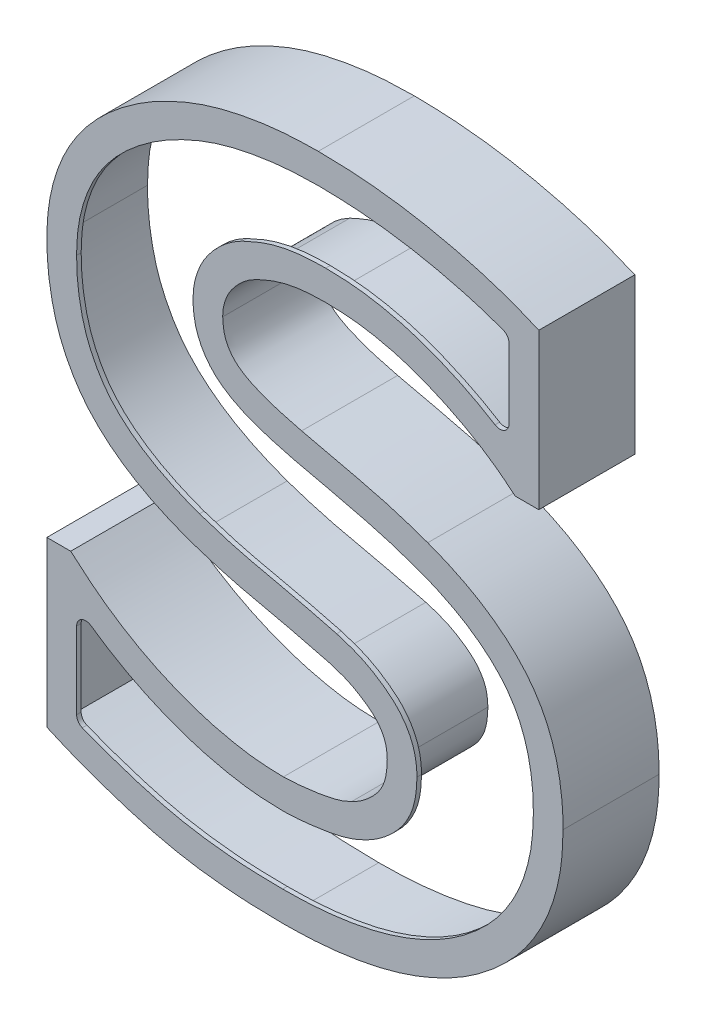
from build123d import *

# Parameters (mm, degrees)
BOSS_EXTRUDE1_DEPTH      = 1
BOSS_EXTRUDE1_DEPTH_BACK = 20
CUT_EXTRUDE3_DEPTH       = 157.135774002
CUT_EXTRUDE4_DEPTH       = 20
FILLET1_R                = 2


with BuildPart() as part:
    # Sketch1 → Boss-Extrude1 (new, two sides: drawn at the far end of the back side and taken through both)
    with BuildSketch(Plane.XY.offset(-BOSS_EXTRUDE1_DEPTH_BACK)):
        with BuildLine():
            Line((3196.172643141, -1601.823084168), (3190.957276755, -1601.823084168))
            Line((3190.957276755, -1601.823084168), (3190.957276755, -1637.755053706))
            add(Edge.make_bspline(
                [(3190.957276755, -1637.755053706), (3192.991834627, -1638.641602204), (3195.022747906, -1639.537347953), (3199.142486331, -1641.18269693), (3201.232171278, -1641.930555643), (3207.533438686, -1644.090240096), (3211.776581134, -1645.393673051), (3218.264885618, -1646.911990673), (3220.440233524, -1647.341547516), (3224.818164413, -1648.034932979), (3227.02002631, -1648.306434503), (3231.439814803, -1648.738122444), (3233.652613354, -1648.891565654), (3238.084303749, -1649.067533936), (3240.302859588, -1649.097278264), (3242.521415183, -1649.127027852)],
                knots=[0, 0, 0, 0, 0.125, 0.125, 0.25, 0.25, 0.5, 0.5, 0.625, 0.625, 0.75, 0.75, 0.875, 0.875, 1, 1, 1, 1], degree=3))
            add(Edge.make_bspline(
                [(3242.521415183, -1649.127027852), (3244.348897425, -1649.100457597), (3246.176360431, -1649.073772369), (3249.814237303, -1648.918493935), (3251.623324901, -1648.781973226), (3255.222893666, -1648.397715432), (3257.01438453, -1648.156013623), (3260.579444897, -1647.565488502), (3262.352526502, -1647.213748875), (3265.875316722, -1646.370562061), (3267.624924981, -1645.878515011), (3270.22918, -1645.019957626), (3271.093992484, -1644.714210958), (3272.817059503, -1644.063518739), (3273.675339525, -1643.718683269), (3277.905527501, -1641.911575733), (3281.129453, -1640.188050604), (3284.903710038, -1637.590332772), (3285.646163256, -1637.049290037), (3287.106656748, -1635.924871127), (3287.826595669, -1635.340031046), (3289.925389886, -1633.540674216), (3291.250659797, -1632.27857699), (3293.115611077, -1630.28143834), (3293.716097338, -1629.597825034), (3294.869196918, -1628.190108008), (3295.421572258, -1627.465803007), (3296.479765544, -1625.977815267), (3296.985622886, -1625.214165847), (3297.710315086, -1624.039855541), (3297.94615297, -1623.643575629), (3298.406036723, -1622.841042247), (3298.630526986, -1622.433918704), (3300.582420103, -1618.749699062), (3301.837034855, -1615.315859193), (3302.861228972, -1610.843510261), (3303.03920589, -1609.940151135), (3303.338794138, -1608.114779965), (3303.460005894, -1607.193392676), (3303.730457385, -1604.430092745), (3303.781118128, -1602.578913125), (3303.831038967, -1600.727682255)],
                knots=[0, 0, 0, 0, 0.0625, 0.0625, 0.125, 0.125, 0.1875, 0.1875, 0.25, 0.25, 0.3125, 0.3125, 0.34375, 0.34375, 0.375, 0.375, 0.5, 0.5, 0.53125, 0.53125, 0.5625, 0.5625, 0.625, 0.625, 0.65625, 0.65625, 0.6875, 0.6875, 0.71875, 0.71875, 0.734375, 0.734375, 0.75, 0.75, 0.875, 0.875, 0.90625, 0.90625, 0.9375, 0.9375, 1, 1, 1, 1], degree=3))
            add(Edge.make_bspline(
                [(3303.831038967, -1600.727682255), (3303.812090528, -1599.615392237), (3303.79314674, -1598.503101537), (3303.68112095, -1596.289411811), (3303.585179992, -1595.188432795), (3303.31851393, -1592.997461332), (3303.149114033, -1591.907274198), (3302.730051864, -1589.738691308), (3302.480892302, -1588.660221698), (3301.883202161, -1586.517881114), (3301.530157021, -1585.44994259), (3300.741731914, -1583.3656124), (3300.309180042, -1582.343893966), (3299.330799204, -1580.360868667), (3298.782647044, -1579.40080078), (3297.589682346, -1577.53221475), (3296.943967326, -1576.622667469), (3295.5401309, -1574.869722656), (3294.796191165, -1574.038750477), (3293.249422724, -1572.440570146), (3292.443465047, -1571.676749995), (3290.761882905, -1570.224543766), (3289.888438271, -1569.533797403), (3288.090183485, -1568.207922432), (3287.164986284, -1567.572361549), (3285.287861665, -1566.369200517), (3284.33076701, -1565.804151559), (3282.378550926, -1564.749013253), (3281.387053728, -1564.251779701), (3279.390498759, -1563.284043636), (3278.381702774, -1562.820910013), (3276.32640528, -1561.968969115), (3275.282534923, -1561.574975229), (3274.238616276, -1561.181076533)],
                knots=[0, 0, 0, 0, 0.0625, 0.0625, 0.125, 0.125, 0.1875, 0.1875, 0.25, 0.25, 0.3125, 0.3125, 0.375, 0.375, 0.4375, 0.4375, 0.5, 0.5, 0.5625, 0.5625, 0.625, 0.625, 0.6875, 0.6875, 0.75, 0.75, 0.8125, 0.8125, 0.875, 0.875, 0.9375, 0.9375, 1, 1, 1, 1], degree=3))
            add(Edge.make_bspline(
                [(3274.238616276, -1561.181076533), (3271.990075283, -1560.397861458), (3269.741514916, -1559.614704405), (3265.186697771, -1558.221179909), (3262.882847762, -1557.621661112), (3255.949587468, -1555.903960961), (3251.306032104, -1554.849865923), (3246.66282357, -1553.794472176)],
                knots=[0, 0, 0, 0, 0.25, 0.25, 0.5, 0.5, 1, 1, 1, 1], degree=3))
            add(Edge.make_bspline(
                [(3246.66282357, -1553.794472176), (3244.757153074, -1553.316482622), (3242.852533179, -1552.834706178), (3240.50761324, -1552.103246456), (3240.040275465, -1551.949531023), (3239.115007965, -1551.62087986), (3238.656591883, -1551.446562391), (3237.285486513, -1550.913795281), (3236.371544185, -1550.558314161), (3235.051333248, -1549.904975331), (3234.617476293, -1549.66837135), (3233.773906132, -1549.158483212), (3233.363555211, -1548.888482855), (3232.581517584, -1548.297569824), (3232.214337579, -1547.97072281), (3231.532670019, -1547.247644344), (3231.226074965, -1546.862910083), (3230.679299567, -1546.0529365), (3230.439314414, -1545.626819092), (3230.137177165, -1544.951052804), (3230.045903751, -1544.718370672), (3229.885407991, -1544.249467976), (3229.815830984, -1544.012785104), (3229.636785468, -1543.296528573), (3229.560363814, -1542.81004406), (3229.458098082, -1541.826498108), (3229.42963958, -1541.330748868), (3229.401645609, -1540.835919436)],
                knots=[0, 0, 0, 0, 0.25, 0.25, 0.3125, 0.3125, 0.375, 0.375, 0.5, 0.5, 0.5625, 0.5625, 0.625, 0.625, 0.6875, 0.6875, 0.75, 0.75, 0.8125, 0.8125, 0.84375, 0.84375, 0.875, 0.875, 0.9375, 0.9375, 1, 1, 1, 1], degree=3))
            add(Edge.make_bspline(
                [(3229.401645609, -1540.835919436), (3229.419611701, -1540.265675495), (3229.436656865, -1539.695255796), (3229.60800735, -1538.580612336), (3229.763258709, -1538.036569126), (3230.127291214, -1536.958698801), (3230.340079521, -1536.423700476), (3230.867217143, -1535.427585851), (3231.179381939, -1534.960212143), (3231.853541143, -1534.056927248), (3232.219030124, -1533.619569559), (3232.989846119, -1532.790206247), (3233.394215868, -1532.398493254), (3234.242073016, -1531.662451083), (3234.684923455, -1531.317350345), (3235.628751582, -1530.697559306), (3236.130858039, -1530.423851497), (3236.631290484, -1530.151038176)],
                knots=[0, 0, 0, 0, 0.125, 0.125, 0.25, 0.25, 0.375, 0.375, 0.5, 0.5, 0.625, 0.625, 0.75, 0.75, 0.875, 0.875, 1, 1, 1, 1], degree=3))
            add(Edge.make_bspline(
                [(3236.631290484, -1530.151038176), (3237.828214124, -1529.60034102), (3239.024992086, -1529.04929924), (3240.8796152, -1528.363388351), (3241.507253035, -1528.16014843), (3242.77291638, -1527.803156136), (3243.41198386, -1527.648890901), (3244.701748939, -1527.385552399), (3245.353087788, -1527.276490221), (3246.656377841, -1527.101430421), (3247.30957995, -1527.035271957), (3249.273331136, -1526.893686022), (3250.587743236, -1526.871279742), (3251.902143608, -1526.848712477)],
                knots=[0, 0, 0, 0, 0.25, 0.25, 0.375, 0.375, 0.5, 0.5, 0.625, 0.625, 0.75, 0.75, 1, 1, 1, 1], degree=3))
            add(Edge.make_bspline(
                [(3251.902143608, -1526.848712477), (3253.799536324, -1526.894677015), (3255.696963749, -1526.940301827), (3259.465744533, -1527.286766697), (3261.336862952, -1527.589906373), (3265.063795701, -1528.345983486), (3266.90456818, -1528.795535189), (3270.508191544, -1529.883731581), (3272.272742536, -1530.524111094), (3275.75509112, -1531.925680524), (3277.473812369, -1532.684483718), (3280.011354518, -1533.927442821), (3280.850280896, -1534.359646344), (3282.514901638, -1535.258244803), (3283.341760978, -1535.725254746), (3285.791753786, -1537.167028702), (3287.38887369, -1538.179808673), (3290.44827007, -1540.397520596), (3291.910857399, -1541.602009584), (3293.379571644, -1542.797767712)],
                knots=[0, 0, 0, 0, 0.125, 0.125, 0.25, 0.25, 0.375, 0.375, 0.5, 0.5, 0.625, 0.625, 0.6875, 0.6875, 0.75, 0.75, 0.875, 0.875, 1, 1, 1, 1], degree=3))
            Line((3293.379571644, -1542.797767712), (3298.51423878, -1542.797767712))
            Line((3298.51423878, -1542.797767712), (3298.51423878, -1508.81538708))
            add(Edge.make_bspline(
                [(3298.51423878, -1508.81538708), (3296.610005173, -1508.019880815), (3294.709570393, -1507.214182361), (3290.852751326, -1505.75289703), (3288.893727717, -1505.103498515), (3284.939855481, -1503.904467758), (3282.949820717, -1503.357036954), (3278.944381968, -1502.363051809), (3276.928750748, -1501.915767203), (3272.879382702, -1501.100021387), (3270.848318538, -1500.733833905), (3266.76822727, -1500.118821969), (3264.719068887, -1499.868696184), (3260.608433638, -1499.45782385), (3258.550748591, -1499.298358854), (3254.428870441, -1499.105803884), (3252.36471726, -1499.071938677), (3250.300564879, -1499.038057919)],
                knots=[0, 0, 0, 0, 0.125, 0.125, 0.25, 0.25, 0.375, 0.375, 0.5, 0.5, 0.625, 0.625, 0.75, 0.75, 0.875, 0.875, 1, 1, 1, 1], degree=3))
            add(Edge.make_bspline(
                [(3250.300564879, -1499.038057919), (3248.552853688, -1499.068743025), (3246.805166811, -1499.099559633), (3243.329802199, -1499.269408513), (3241.603348095, -1499.415058571), (3238.171337523, -1499.819379611), (3236.465245277, -1500.075152937), (3233.072711165, -1500.692974973), (3231.386047161, -1501.053822282), (3228.035842018, -1501.900572566), (3226.372867516, -1502.389540086), (3223.899613386, -1503.237688803), (3223.078653871, -1503.539109834), (3221.443917624, -1504.180798635), (3220.628122575, -1504.522209405), (3219.015890217, -1505.236154243), (3218.219236074, -1505.608605539), (3216.642748689, -1506.381025318), (3215.862658388, -1506.780573283), (3214.321941099, -1507.611509104), (3213.56135125, -1508.042957717), (3212.063148529, -1508.943442812), (3211.325826545, -1509.412955154), (3209.873256459, -1510.388090346), (3209.15795627, -1510.893627985), (3207.747657281, -1511.937914158), (3207.052369079, -1512.476189261), (3205.68442446, -1513.589762639), (3205.010587459, -1514.16642401), (3203.703436411, -1515.349610847), (3203.068715245, -1515.957360003), (3201.223019072, -1517.830706384), (3200.070245055, -1519.146174304), (3198.468482918, -1521.228540501), (3197.955835737, -1521.940891222), (3197.220845335, -1523.038534072), (3196.981522898, -1523.409277215), (3196.514717664, -1524.160908536), (3196.286956793, -1524.542339303), (3195.187965704, -1526.460183205), (3194.432732895, -1528.040352698), (3193.147267731, -1531.283994759), (3192.61452607, -1532.946538294), (3191.973808503, -1535.498996965), (3191.786323006, -1536.359474855), (3191.46889033, -1538.101733343), (3191.340467664, -1538.976439096), (3191.054316819, -1541.607340617), (3191.005000657, -1543.373125449), (3190.956929199, -1545.139014559)],
                knots=[0, 0, 0, 0, 0.0625, 0.0625, 0.125, 0.125, 0.1875, 0.1875, 0.25, 0.25, 0.3125, 0.3125, 0.34375, 0.34375, 0.375, 0.375, 0.40625, 0.40625, 0.4375, 0.4375, 0.46875, 0.46875, 0.5, 0.5, 0.53125, 0.53125, 0.5625, 0.5625, 0.59375, 0.59375, 0.625, 0.625, 0.6875, 0.6875, 0.71875, 0.71875, 0.734375, 0.734375, 0.75, 0.75, 0.8125, 0.8125, 0.875, 0.875, 0.90625, 0.90625, 0.9375, 0.9375, 1, 1, 1, 1], degree=3))
            add(Edge.make_bspline(
                [(3190.956929199, -1545.139014559), (3190.976895695, -1546.311752716), (3190.996903714, -1547.484484308), (3191.120911284, -1549.81667024), (3191.226531207, -1550.975868433), (3191.520625188, -1553.281167365), (3191.70948452, -1554.427207199), (3192.155457489, -1556.708497332), (3192.410243212, -1557.844115623), (3192.880014337, -1559.533696565), (3193.05162837, -1560.094515295), (3193.421281638, -1561.2119755), (3193.619720749, -1561.769708937), (3194.243520939, -1563.42422998), (3194.700106162, -1564.504780014), (3195.477544531, -1566.074540249), (3195.750899382, -1566.589954832), (3196.318808095, -1567.609088694), (3196.612470304, -1568.11329989), (3197.21863281, -1569.111329477), (3197.532337724, -1569.604483291), (3198.190985174, -1570.573557404), (3198.537100364, -1571.048830759), (3199.26229807, -1571.981189692), (3199.641070157, -1572.438976566), (3200.414954675, -1573.330540996), (3200.810826897, -1573.766292083), (3202.025763706, -1575.042856326), (3202.873804342, -1575.851120363), (3204.644347536, -1577.384004533), (3205.565330007, -1578.110332196), (3207.467046353, -1579.495868105), (3208.450142551, -1580.157849404), (3211.448638321, -1582.033004169), (3213.524428665, -1583.125444131), (3216.710394111, -1584.615706933), (3217.786004435, -1585.084494345), (3219.965065596, -1585.964910112), (3221.066821818, -1586.380017663), (3222.168538993, -1586.795205381)],
                knots=[0, 0, 0, 0, 0.0625, 0.0625, 0.125, 0.125, 0.1875, 0.1875, 0.25, 0.25, 0.28125, 0.28125, 0.3125, 0.3125, 0.375, 0.375, 0.40625, 0.40625, 0.4375, 0.4375, 0.46875, 0.46875, 0.5, 0.5, 0.53125, 0.53125, 0.5625, 0.5625, 0.625, 0.625, 0.6875, 0.6875, 0.75, 0.75, 0.875, 0.875, 0.9375, 0.9375, 1, 1, 1, 1], degree=3))
            add(Edge.make_bspline(
                [(3222.168538993, -1586.795205381), (3224.654424843, -1587.610275414), (3227.140303428, -1588.425368808), (3232.182289397, -1589.829755107), (3234.730739932, -1590.420367107), (3239.836589079, -1591.563994426), (3242.393864925, -1592.117592958), (3247.485276736, -1593.321770116), (3250.018330221, -1593.976899528), (3252.55131125, -1594.632332691)],
                knots=[0, 0, 0, 0, 0.25, 0.25, 0.5, 0.5, 0.75, 0.75, 1, 1, 1, 1], degree=3))
            add(Edge.make_bspline(
                [(3252.55131125, -1594.632332691), (3254.067300135, -1595.098073695), (3255.583428227, -1595.563512268), (3257.372180855, -1596.376482976), (3257.724156414, -1596.551623354), (3258.416423038, -1596.927288915), (3258.757208454, -1597.126740113), (3259.431869697, -1597.540653733), (3259.766012507, -1597.754536131), (3260.429620411, -1598.19246336), (3260.759588081, -1598.418566245), (3261.72239707, -1599.124835233), (3262.325849669, -1599.635633186), (3263.14157027, -1600.494855335), (3263.398885887, -1600.796435756), (3263.878580491, -1601.435926239), (3264.100344506, -1601.773683039), (3264.48936104, -1602.467667099), (3264.658253087, -1602.82653022), (3264.942053791, -1603.569273489), (3265.057927328, -1603.956249174), (3265.2253593, -1604.741199444), (3265.275346088, -1605.137647006), (3265.345681697, -1605.934032717), (3265.366070802, -1606.333966121), (3265.386042828, -1606.733948646)],
                knots=[0, 0, 0, 0, 0.25, 0.25, 0.3125, 0.3125, 0.375, 0.375, 0.4375, 0.4375, 0.5, 0.5, 0.625, 0.625, 0.6875, 0.6875, 0.75, 0.75, 0.8125, 0.8125, 0.875, 0.875, 0.9375, 0.9375, 1, 1, 1, 1], degree=3))
            add(Edge.make_bspline(
                [(3265.386042828, -1606.733948646), (3265.332175266, -1607.980444514), (3265.273552253, -1609.226242804), (3264.900651101, -1610.739539091), (3264.810476692, -1611.040386299), (3264.596155069, -1611.635135977), (3264.474732429, -1611.924028228), (3264.074314175, -1612.769203642), (3263.76250529, -1613.305970271), (3263.032664591, -1614.316324716), (3262.604026787, -1614.787197628), (3261.718603178, -1615.677667595), (3261.262629765, -1616.106313893), (3260.299900359, -1616.900083556), (3259.791866507, -1617.263608471), (3258.721965971, -1617.923319867), (3258.159922579, -1618.219394209), (3257.599737938, -1618.514825736)],
                knots=[0, 0, 0, 0, 0.25, 0.25, 0.3125, 0.3125, 0.375, 0.375, 0.5, 0.5, 0.625, 0.625, 0.75, 0.75, 0.875, 0.875, 1, 1, 1, 1], degree=3))
            add(Edge.make_bspline(
                [(3257.599737938, -1618.514825736), (3257.021267091, -1618.794331591), (3256.442425356, -1619.072585042), (3255.251819561, -1619.517920694), (3254.643481559, -1619.696571914), (3253.415464433, -1620.015577951), (3252.795013427, -1620.153326294), (3251.545934001, -1620.401209697), (3250.916400521, -1620.510685262), (3249.653630995, -1620.703938356), (3249.020569965, -1620.787653271), (3247.75272799, -1620.941835267), (3247.117985326, -1621.013451938), (3245.84709834, -1621.141991845), (3245.211251947, -1621.20007903), (3243.937310064, -1621.281739576), (3243.298849743, -1621.29971436), (3242.660293775, -1621.316221381)],
                knots=[0, 0, 0, 0, 0.125, 0.125, 0.25, 0.25, 0.375, 0.375, 0.5, 0.5, 0.625, 0.625, 0.75, 0.75, 0.875, 0.875, 1, 1, 1, 1], degree=3))
            add(Edge.make_bspline(
                [(3242.660293775, -1621.316221381), (3241.581443395, -1621.286504883), (3240.50261444, -1621.256612368), (3238.35071431, -1621.149521617), (3237.277805247, -1621.070991487), (3235.143018738, -1620.823295857), (3234.080536901, -1620.659096021), (3231.962396513, -1620.274636487), (3230.906574791, -1620.055717388), (3228.799790178, -1619.577959225), (3227.751520518, -1619.317248912), (3225.678619053, -1618.748077139), (3224.652720281, -1618.438495198), (3221.60692253, -1617.434186336), (3219.6167186, -1616.66911618), (3215.700443453, -1614.987054839), (3213.776709782, -1614.064526348), (3210.949357189, -1612.542752811), (3210.016283518, -1612.013281764), (3208.167686169, -1610.912766303), (3207.250526974, -1610.341109808), (3204.540901632, -1608.575566536), (3202.790497125, -1607.325353329), (3199.425599504, -1604.647348548), (3197.801552821, -1603.232039424), (3196.172643141, -1601.823084168)],
                knots=[0, 0, 0, 0, 0.0625, 0.0625, 0.125, 0.125, 0.1875, 0.1875, 0.25, 0.25, 0.3125, 0.3125, 0.375, 0.375, 0.5, 0.5, 0.625, 0.625, 0.6875, 0.6875, 0.75, 0.75, 0.875, 0.875, 1, 1, 1, 1], degree=3))
        make_face()
    extrude(amount=BOSS_EXTRUDE1_DEPTH + BOSS_EXTRUDE1_DEPTH_BACK)

    # 3DSketch3 → Cut-Extrude3 (cut, through all)
    with BuildSketch(Plane(origin=(3197.457276754, -1611.385744091, 1), x_dir=(0.6935425068211774, 0.7204157072358967, 0), z_dir=(0, 0, -1))):
        with BuildLine():
            Line((0, 0), (-15.916938943, 15.323199682))
            add(Edge.make_bspline(
                [(-15.916938943, 15.323199682), (-15.695170344, 15.900075679), (-15.47079654, 16.475928636), (-15.243091821, 17.050434333), (-14.462339414, 18.980185353), (-13.627313875, 20.88728784), (-13.018665468, 22.219024521), (-11.776205432, 24.852724022), (-10.490974451, 27.465197226), (-9.837610173, 28.756522998), (-8.506655455, 31.296386826), (-7.08854671, 33.790322845), (-6.363108611, 35.012398523), (-4.862251697, 37.427263806), (-3.256378408, 39.773096821), (-2.429703857, 40.930596252), (-0.722729146, 43.233454283), (1.055074851, 45.481614428), (1.968829061, 46.599466985), (3.530856611, 48.446808911), (5.144930156, 50.248358996), (5.802332326, 50.969096807), (6.785486568, 52.033512008), (7.7742257, 53.092516417), (8.09769841, 53.438151029), (8.421384567, 53.783578848), (8.74509276, 54.128985316)],
                knots=[0, 0, 0, 0, 0, 0, 0.066712718, 0.066712718, 0.066712718, 0.224740304, 0.224740304, 0.224740304, 0.380960058, 0.380960058, 0.380960058, 0.534292009, 0.534292009, 0.534292009, 0.687778208, 0.687778208, 0.687778208, 0.843592738, 0.843592738, 0.843592738, 0.948894347, 0.948894347, 0.948894347, 1, 1, 1, 1, 1, 1], degree=5))
            add(Edge.make_bspline(
                [(8.74509276, 54.128985316), (8.980690815, 54.366693505), (9.216304213, 54.604387105), (9.452026758, 54.841976094), (10.173025629, 55.567463881), (10.896797085, 56.290294289), (11.386247706, 56.774058617), (12.613871692, 57.968492108), (13.872632172, 59.130599402), (14.63641705, 59.814121397), (16.168125299, 61.143156018), (17.738881049, 62.425500787), (18.525134686, 63.048107671), (20.197175636, 64.33195702), (21.909170574, 65.562693153), (22.818609288, 66.19099884), (24.753306769, 67.468661864), (26.748691186, 68.651524045), (27.808550914, 69.243800536), (30.038138263, 70.415677763), (32.327388467, 71.466232757), (33.528613612, 71.975885238), (35.853146158, 72.880337184), (38.229188277, 73.643994241), (39.37297023, 73.973479134), (41.556880291, 74.526574806), (43.771256844, 74.935998108), (44.821689588, 75.098081651), (46.816580485, 75.347461543), (48.821936192, 75.491763979), (49.768594271, 75.534289245), (51.651968623, 75.563895675), (53.53450151, 75.475789348), (54.468450629, 75.401937065), (56.318883893, 75.193387012), (58.1506124, 74.858245378), (59.055180973, 74.661229924), (60.85618732, 74.206459241), (62.623822834, 73.635787325), (63.500755969, 73.320399575), (65.138506026, 72.668795634), (66.730838588, 71.913514272), (67.471001603, 71.53568934), (68.840873449, 70.787467412), (70.170806462, 69.97143609), (70.783151432, 69.574722949), (71.924655821, 68.793198968), (73.025438326, 67.955449538), (73.537306316, 67.54828882), (74.382885604, 66.84885245), (75.207912748, 66.126118872), (75.538704261, 65.831298483), (76.02268576, 65.394989257), (76.504844884, 64.956713701), (76.658999744, 64.816326976), (76.813077396, 64.675856944), (76.967132537, 64.535362622)],
                knots=[0, 0, 0, 0, 0, 0, 0.021560593, 0.021560593, 0.021560593, 0.065890122, 0.065890122, 0.065890122, 0.131896829, 0.131896829, 0.131896829, 0.196489047, 0.196489047, 0.196489047, 0.26766733, 0.26766733, 0.26766733, 0.345799948, 0.345799948, 0.345799948, 0.42977147, 0.42977147, 0.42977147, 0.506327302, 0.506327302, 0.506327302, 0.574732488, 0.574732488, 0.574732488, 0.635717767, 0.635717767, 0.635717767, 0.695981503, 0.695981503, 0.695981503, 0.755531895, 0.755531895, 0.755531895, 0.815480347, 0.815480347, 0.815480347, 0.868947063, 0.868947063, 0.868947063, 0.915915415, 0.915915415, 0.915915415, 0.958024713, 0.958024713, 0.958024713, 0.98656827, 0.98656827, 0.98656827, 1, 1, 1, 1, 1, 1], degree=5))
            add(Edge.make_bspline(
                [(76.967132537, 64.535362622), (77.093990655, 64.40898879), (77.220826643, 64.28259184), (77.347594249, 64.156123583), (77.755852308, 63.74807576), (78.162439108, 63.338285188), (78.441209432, 63.053972912), (79.125719939, 62.343237569), (79.789006595, 61.612282656), (80.176927182, 61.169292299), (80.923143306, 60.286140435), (81.638196718, 59.377756666), (81.981374625, 58.925961394), (82.64826737, 58.01532854), (83.282787241, 57.08141372), (83.589154349, 56.610841601), (84.175538376, 55.665756709), (84.716418633, 54.694013564), (84.973620081, 54.206810058), (85.461913775, 53.233157853), (85.912275049, 52.241031827), (86.123517442, 51.745899259), (86.516420275, 50.752480154), (86.84874865, 49.736840175), (86.999292568, 49.228112207), (87.320556569, 48.023317388), (87.568224271, 46.801504136), (87.686261411, 46.094932304), (87.901540371, 44.46539141), (87.989512556, 42.822256335), (88.001920259, 41.893135637), (87.958567283, 40.02173317), (87.790906519, 38.160182117), (87.677084406, 37.225916086), (87.419392444, 35.526504893), (87.077928384, 33.842756948), (86.90624657, 33.084477957), (86.574193962, 31.758450655), (86.189202869, 30.447275742), (86.015125724, 29.883972709), (85.648876458, 28.743020665), (85.264874294, 27.60784941), (85.063164367, 27.033674011), (84.712338839, 26.08209366), (84.331361993, 25.142164081), (84.175415042, 24.767519571), (83.942258289, 24.216653584), (83.707063002, 23.666757449), (83.631285683, 23.489998186), (83.555426896, 23.313277682), (83.479551306, 23.136565172)],
                knots=[0, 0, 0, 0, 0, 0, 0.019748125, 0.019748125, 0.019748125, 0.063656856, 0.063656856, 0.063656856, 0.128567156, 0.128567156, 0.128567156, 0.191117743, 0.191117743, 0.191117743, 0.253005259, 0.253005259, 0.253005259, 0.313731143, 0.313731143, 0.313731143, 0.373049362, 0.373049362, 0.373049362, 0.431493862, 0.431493862, 0.431493862, 0.510413352, 0.510413352, 0.510413352, 0.612581956, 0.612581956, 0.612581956, 0.716236747, 0.716236747, 0.716236747, 0.801930952, 0.801930952, 0.801930952, 0.866941832, 0.866941832, 0.866941832, 0.93404332, 0.93404332, 0.93404332, 0.978790468, 0.978790468, 0.978790468, 1, 1, 1, 1, 1, 1], degree=5))
            add(Edge.make_bspline(
                [(83.479551306, 23.136565172), (83.329218198, 22.809824369), (83.178869806, 22.483090323), (83.028395777, 22.156410797), (82.574674019, 21.173229969), (82.117814056, 20.191410973), (81.809641008, 19.537165489), (81.026431467, 17.90530007), (80.203143326, 16.29305344), (79.695928256, 15.331469572), (78.665481756, 13.432229322), (77.597006983, 11.554667503), (77.059247654, 10.625698899), (75.944872923, 8.721243345), (74.822780203, 6.821415064), (74.244569171, 5.846974601), (73.270544003, 4.212850794), (72.291255537, 2.581862025), (71.894600884, 1.922677678), (71.287721512, 0.915546421), (70.672940163, -0.103708161), (70.455467645, -0.464174017), (70.237978622, -0.824629775), (70.020490188, -1.185085893), (70.013017022, -1.197471602)],
                knots=[0, 0, 0, 0, 0, 0, 0.064613352, 0.064613352, 0.064613352, 0.194522523, 0.194522523, 0.194522523, 0.389780192, 0.389780192, 0.389780192, 0.582607391, 0.582607391, 0.582607391, 0.786163168, 0.786163168, 0.786163168, 0.924370446, 0.924370446, 0.924370446, 0.997401277, 1, 1, 1, 1, 1, 1], degree=5))
            add(Edge.make_bspline(
                [(70.013017022, -1.197471602), (70.005821314, -1.210020538), (69.998625605, -1.222569473), (69.853017963, -1.476501507), (69.707403906, -1.730429692), (69.561926091, -1.984439599), (69.142729936, -2.718130638), (68.726947973, -3.453869587), (68.450839786, -3.948861064), (67.75721105, -5.21599477), (67.097348951, -6.501019153), (66.709153133, -7.288481721), (66.020200473, -8.746910671), (65.37648859, -10.227477444), (65.096640449, -10.907506592), (64.623743239, -12.144583245), (64.220359762, -13.405932604), (64.055881721, -13.971875314), (63.7950681, -14.97583937), (63.5887288, -15.992851782), (63.511474412, -16.434347875), (63.379169842, -17.355779128), (63.312749913, -18.285319406), (63.296596969, -18.768550077), (63.301867633, -19.707351905), (63.380471087, -20.64275924), (63.435457273, -21.0949374), (63.569923099, -21.941527311), (63.761228282, -22.776567492), (63.863580433, -23.164865232), (64.078726986, -23.882983009), (64.33936554, -24.585960659), (64.470057467, -24.908835912), (64.768259382, -25.587325238), (65.108356472, -26.245775277), (65.300054052, -26.588754275), (65.707181809, -27.264421709), (66.157503799, -27.912297277), (66.393315072, -28.230662756), (66.810306362, -28.762314537), (67.249206943, -29.27496733), (67.433829924, -29.484420609), (67.700775207, -29.78058967), (67.970933652, -30.073754146), (68.052111081, -30.161455565), (68.172314843, -30.291032852), (68.292518605, -30.42061014), (68.331448692, -30.462576006), (68.370378778, -30.504541872), (68.409308864, -30.546507738)],
                knots=[0, 0, 0, 0, 0, 0, 0.002246861, 0.002246861, 0.045466016, 0.045466016, 0.045466016, 0.133492009, 0.133492009, 0.133492009, 0.269833312, 0.269833312, 0.269833312, 0.383912937, 0.383912937, 0.383912937, 0.475392088, 0.475392088, 0.475392088, 0.544939264, 0.544939264, 0.544939264, 0.619866159, 0.619866159, 0.619866159, 0.69046605, 0.69046605, 0.69046605, 0.752763621, 0.752763621, 0.752763621, 0.806799803, 0.806799803, 0.806799803, 0.867753586, 0.867753586, 0.867753586, 0.929188207, 0.929188207, 0.929188207, 0.972547021, 0.972547021, 0.972547021, 0.991108873, 0.991108873, 0.991108873, 1, 1, 1, 1, 1, 1], degree=5))
            add(Edge.make_bspline(
                [(68.409308864, -30.546507738), (68.45177686, -30.584889437), (68.494244857, -30.623271137), (68.536712853, -30.661652836), (68.654249877, -30.767880376), (68.771786902, -30.874107915), (68.846945747, -30.941855882), (69.096963259, -31.166033986), (69.349948243, -31.386978419), (69.528654722, -31.539090701), (69.98313057, -31.913330558), (70.456268396, -32.264876831), (70.747179947, -32.467606979), (71.358034244, -32.865851559), (71.992756906, -33.223351236), (72.324224375, -33.397634365), (72.98568095, -33.725023863), (73.659538413, -34.025966252), (73.994661336, -34.166484322), (74.671564518, -34.429443308), (75.363477649, -34.651458445), (75.712481521, -34.752188805), (76.453114819, -34.942799968), (77.203465129, -35.088154935), (77.599605878, -35.15321045), (78.431309438, -35.268208477), (79.26738019, -35.344457925), (79.704512666, -35.373653267), (80.631124947, -35.412949046), (81.55850131, -35.404376437), (82.047661938, -35.386460977), (83.014076067, -35.324405042), (83.9763318, -35.209455329), (84.450227523, -35.138363573), (85.235795934, -34.993842799), (86.010842071, -34.802373559), (86.319591214, -34.719349193), (86.770388633, -34.58992793), (87.218300236, -34.451826916), (87.360691142, -34.407278165), (87.54509486, -34.349165703), (87.729498579, -34.291053242), (87.771608871, -34.277782725), (87.813719162, -34.264512207), (87.855829454, -34.25124169)],
                knots=[0, 0, 0, 0, 0, 0, 0.013739626, 0.013739626, 0.013739626, 0.038026629, 0.038026629, 0.038026629, 0.094338228, 0.094338228, 0.094338228, 0.179290557, 0.179290557, 0.179290557, 0.269110399, 0.269110399, 0.269110399, 0.356270713, 0.356270713, 0.356270713, 0.443339288, 0.443339288, 0.443339288, 0.539618085, 0.539618085, 0.539618085, 0.644685774, 0.644685774, 0.644685774, 0.762075937, 0.762075937, 0.762075937, 0.87691123, 0.87691123, 0.87691123, 0.953592565, 0.953592565, 0.953592565, 0.989402434, 0.989402434, 0.989402434, 1, 1, 1, 1, 1, 1], degree=5))
            add(Edge.make_bspline(
                [(87.855829454, -34.25124169), (87.896942338, -34.235144669), (87.938055222, -34.219047648), (87.979168106, -34.202950627), (88.201217922, -34.116010958), (88.423267739, -34.029071289), (88.604155764, -33.958101396), (89.162538933, -33.738119927), (89.719522491, -33.514496997), (90.095079235, -33.360582609), (91.046093032, -32.959754056), (91.984245655, -32.528187962), (92.547669251, -32.254043302), (93.676252421, -31.671233949), (94.772600653, -31.029682902), (95.319905935, -30.690446964), (96.391870324, -29.989622066), (97.430560617, -29.240847179), (97.938586792, -28.857057169), (98.913122837, -28.086417426), (99.853724223, -27.275055716), (100.305041432, -26.870978687), (101.039105958, -26.192100428), (101.757241899, -25.49691133), (102.038362399, -25.220927031), (102.452624655, -24.810112555), (102.865005586, -24.397433521), (102.998800788, -24.263278111), (103.151520299, -24.109996841), (103.30423981, -23.956715572), (103.323230262, -23.937655266), (103.342220713, -23.918594961), (103.361211165, -23.899534655)],
                knots=[0, 0, 0, 0, 0, 0, 0.011724386, 0.011724386, 0.011724386, 0.063323162, 0.063323162, 0.063323162, 0.171090803, 0.171090803, 0.171090803, 0.33734399, 0.33734399, 0.33734399, 0.508181057, 0.508181057, 0.508181057, 0.677143924, 0.677143924, 0.677143924, 0.837934339, 0.837934339, 0.837934339, 0.942542098, 0.942542098, 0.942542098, 0.992855192, 0.992855192, 0.992855192, 1, 1, 1, 1, 1, 1], degree=5))
            add(Edge.make_bspline(
                [(103.361211165, -23.899534655), (103.379396713, -23.87970492), (103.397582261, -23.859875186), (103.415767809, -23.840045452), (103.655399296, -23.578748472), (103.895030783, -23.317451492), (104.116283818, -23.075799397), (104.780366176, -22.348111522), (105.439216815, -21.615410393), (105.874692242, -21.12263746), (106.960658071, -19.862759331), (107.994901944, -18.559263323), (108.602070445, -17.756636516), (109.780767857, -16.126381869), (110.892273759, -14.4505294), (111.431587299, -13.602504331), (112.481833903, -11.882734686), (113.472209031, -10.127481973), (113.952214048, -9.238576969), (114.965604614, -7.269351938), (115.886560189, -5.255272916), (116.362946539, -4.148506172), (117.358334312, -1.70512947), (118.262825563, 0.772669097), (118.7268103, 2.128524149), (119.662367907, 5.057779354), (120.466599677, 8.028231814), (120.852285856, 9.625410545), (121.240517015, 11.484829126), (121.553441922, 13.357505443), (121.594464442, 13.611246041), (121.634188133, 13.865200591), (121.67265362, 14.11935459)],
                knots=[0, 0, 0, 0, 0, 0, 0.003140848, 0.003140848, 0.003140848, 0.041387049, 0.041387049, 0.041387049, 0.11813585, 0.11813585, 0.11813585, 0.235527906, 0.235527906, 0.235527906, 0.352798176, 0.352798176, 0.352798176, 0.470664566, 0.470664566, 0.470664566, 0.611239697, 0.611239697, 0.611239697, 0.77844678, 0.77844678, 0.77844678, 0.9700074, 0.9700074, 0.9700074, 1, 1, 1, 1, 1, 1], degree=5))
            Line((121.67265362, 14.11935459), (136.339101202, 0))
            add(Edge.make_bspline(
                [(136.339101202, 0), (136.159987849, -0.441557905), (135.97871238, -0.882211214), (135.794738856, -1.321713751), (135.082512294, -2.98847606), (134.315719557, -4.63145566), (133.72527233, -5.83095554), (132.497712298, -8.219318012), (131.204352737, -10.571257851), (130.539099582, -11.743190012), (129.182164083, -14.062975999), (127.767926532, -16.348770536), (127.047906413, -17.479123973), (125.571735286, -19.727122157), (124.030258341, -21.930688093), (123.241129914, -23.025113879), (121.636833145, -25.186312889), (119.975068545, -27.304017727), (119.131010192, -28.347863677), (117.690194578, -30.072873501), (116.200508065, -31.755486443), (115.594163869, -32.427717223), (114.692749, -33.413290944), (113.78481423, -34.392628304), (113.491820759, -34.707722912), (113.198579652, -35.022580655), (112.905305505, -35.337406794)],
                knots=[0, 0, 0, 0, 0, 0, 0.05587978, 0.05587978, 0.05587978, 0.212593297, 0.212593297, 0.212593297, 0.37062696, 0.37062696, 0.37062696, 0.527769057, 0.527769057, 0.527769057, 0.685982192, 0.685982192, 0.685982192, 0.843374159, 0.843374159, 0.843374159, 0.949536075, 0.949536075, 0.949536075, 1, 1, 1, 1, 1, 1], degree=5))
            add(Edge.make_bspline(
                [(112.905305505, -35.337406794), (112.684032406, -35.559315914), (112.462738837, -35.781205438), (112.241328391, -36.002982231), (111.558352501, -36.685795407), (110.872434092, -37.365770487), (110.406492299, -37.82244337), (109.238022229, -38.948284842), (108.037875834, -40.040930434), (107.30925838, -40.682107655), (105.845631355, -41.926836344), (104.34132, -43.121717895), (103.587439483, -43.701037322), (101.983653763, -44.8942943), (100.342864071, -46.036352449), (99.471611467, -46.619371791), (97.617270553, -47.807003743), (95.709171128, -48.908926088), (94.69510305, -49.461055751), (92.553612055, -50.555217134), (90.353681113, -51.525274166), (89.195702533, -51.997365904), (86.950980095, -52.843260363), (84.667287982, -53.579383415), (83.565620494, -53.903421159), (81.459865589, -54.458507279), (79.325518809, -54.889038866), (78.31081958, -55.065252557), (76.387491376, -55.347038316), (74.452411297, -55.534612072), (73.540678728, -55.599664805), (71.733651656, -55.678047019), (69.924545224, -55.647654219), (69.030102064, -55.605385803), (67.26170946, -55.466505054), (65.505088204, -55.216018398), (64.63964621, -55.063281105), (62.924598494, -54.698568565), (61.240415756, -54.209124995), (60.409149655, -53.93476647), (58.856508865, -53.360479808), (57.346211098, -52.684799399), (56.644016866, -52.345189729), (55.34754699, -51.672192665), (54.086870916, -50.934845593), (53.508328982, -50.57643854), (52.429315509, -49.866437655), (51.391483174, -49.097486734), (50.909077822, -48.72174185), (50.114872621, -48.074790671), (49.342847758, -47.40249699), (49.034336376, -47.128442308), (48.583000613, -46.722263108), (48.13353654, -46.314078783), (47.989670482, -46.183155829), (47.845884964, -46.052146594), (47.702124194, -45.921110846)],
                knots=[0, 0, 0, 0, 0, 0, 0.021247441, 0.021247441, 0.021247441, 0.06547803, 0.06547803, 0.06547803, 0.131255466, 0.131255466, 0.131255466, 0.195698449, 0.195698449, 0.195698449, 0.266749901, 0.266749901, 0.266749901, 0.344949258, 0.344949258, 0.344949258, 0.42965748, 0.42965748, 0.42965748, 0.507424926, 0.507424926, 0.507424926, 0.577196347, 0.577196347, 0.577196347, 0.639112268, 0.639112268, 0.639112268, 0.699747916, 0.699747916, 0.699747916, 0.759240007, 0.759240007, 0.759240007, 0.818484231, 0.818484231, 0.818484231, 0.871305394, 0.871305394, 0.871305394, 0.917408804, 0.917408804, 0.917408804, 0.95883528, 0.95883528, 0.95883528, 0.986811364, 0.986811364, 0.986811364, 1, 1, 1, 1, 1, 1], degree=5))
            add(Edge.make_bspline(
                [(47.702124194, -45.921110846), (47.567652971, -45.787155399), (47.433206856, -45.653173688), (47.298841355, -45.519108203), (46.868003176, -45.08834261), (46.439137409, -44.655527246), (46.145780894, -44.355700142), (45.423736204, -43.603662291), (44.725248435, -42.829207899), (44.316481005, -42.358553301), (43.529424261, -41.417085768), (42.778243043, -40.447121207), (42.416786265, -39.963580316), (41.671275502, -38.932856813), (40.957272336, -37.879790063), (40.593162073, -37.319276996), (39.868502828, -36.144118517), (39.210664002, -34.928818846), (38.889530223, -34.291972387), (38.26094544, -32.949454757), (37.715565886, -31.572027124), (37.454497266, -30.848725592), (36.97809983, -29.395306536), (36.585073294, -27.915876788), (36.413631267, -27.174497713), (36.123347279, -25.670722449), (35.957447372, -24.147939981), (35.902746279, -23.378106423), (35.844911548, -21.817215938), (35.88299216, -20.257280309), (35.925709184, -19.469104899), (36.051003589, -17.95482223), (36.255138095, -16.449267966), (36.370313736, -15.728106475), (36.625474576, -14.329979519), (36.936651217, -12.943877457), (37.100473183, -12.272911439), (37.435979061, -10.997072674), (37.812028949, -9.732689143), (37.999841799, -9.132825939), (38.400074243, -7.91238267), (38.831564867, -6.702686845), (39.059995567, -6.087966958), (39.453969119, -5.06911916), (39.870228202, -4.059324493), (40.039253532, -3.656792294), (40.286973751, -3.073878865), (40.536408837, -2.491734615), (40.614023817, -2.310919211), (40.691707859, -2.130134784), (40.769412726, -1.949359697)],
                knots=[0, 0, 0, 0, 0, 0, 0.019689006, 0.019689006, 0.019689006, 0.063196076, 0.063196076, 0.063196076, 0.12782584, 0.12782584, 0.12782584, 0.19043064, 0.19043064, 0.19043064, 0.259732559, 0.259732559, 0.259732559, 0.333600712, 0.333600712, 0.333600712, 0.413294469, 0.413294469, 0.413294469, 0.492091777, 0.492091777, 0.492091777, 0.571995429, 0.571995429, 0.571995429, 0.653797211, 0.653797211, 0.653797211, 0.729487127, 0.729487127, 0.729487127, 0.801108009, 0.801108009, 0.801108009, 0.866293847, 0.866293847, 0.866293847, 0.934304479, 0.934304479, 0.934304479, 0.979588876, 0.979588876, 0.979588876, 1, 1, 1, 1, 1, 1], degree=5))
            add(Edge.make_bspline(
                [(40.769412726, -1.949359697), (40.88569392, -1.708377664), (41.001990669, -1.467402905), (41.118351564, -1.226459132), (41.48242938, -0.473478676), (41.848085354, 0.278739475), (42.098150269, 0.789637476), (42.725526435, 2.058526793), (43.369639945, 3.319247425), (43.761957572, 4.069708002), (44.570924191, 5.577090461), (45.417212622, 7.063739858), (45.852054289, 7.810349624), (46.749172143, 9.325597813), (47.65986367, 10.832420593), (48.126040493, 11.598437697), (49.069149997, 13.142887559), (50.012156657, 14.687483661), (50.486556525, 15.467501984), (51.426246499, 17.024288206), (52.350385574, 18.590386068), (52.806976166, 19.37232564), (53.560491666, 20.675346538), (54.305655615, 21.983117195), (54.601543232, 22.50474894), (55.047183403, 23.29282541), (55.50628982, 24.106788203), (55.670691981, 24.398451462), (55.835065127, 24.690131018), (55.999441099, 24.981808987), (56.013759629, 25.007216591)],
                knots=[0, 0, 0, 0, 0, 0, 0.043180121, 0.043180121, 0.043180121, 0.134973993, 0.134973993, 0.134973993, 0.27160926, 0.27160926, 0.27160926, 0.411024889, 0.411024889, 0.411024889, 0.555739442, 0.555739442, 0.555739442, 0.70306817, 0.70306817, 0.70306817, 0.849189626, 0.849189626, 0.849189626, 0.945969335, 0.945969335, 0.945969335, 0.995293475, 1, 1, 1, 1, 1, 1], degree=5))
            add(Edge.make_bspline(
                [(56.013759629, 25.007216591), (56.026924327, 25.033240761), (56.040089026, 25.05926493), (56.053253724, 25.085289099), (56.174991949, 25.325943009), (56.296730174, 25.566596919), (56.405056481, 25.781357497), (56.743290134, 26.455812664), (57.074226833, 27.134129664), (57.293841768, 27.598975354), (57.824825345, 28.776201557), (58.288430211, 29.983482432), (58.54221298, 30.719734494), (58.961556111, 32.091113027), (59.289280486, 33.485838191), (59.421234831, 34.127476237), (59.624531571, 35.263738706), (59.780354996, 36.407479974), (59.836389745, 36.903377482), (59.909773815, 37.767567585), (59.93387653, 38.634827731), (59.934942269, 39.003499589), (59.917797448, 39.756841956), (59.859988574, 40.508289496), (59.819586174, 40.891168781), (59.719382403, 41.632809016), (59.576065592, 42.367516464), (59.496202859, 42.722188845), (59.324743874, 43.391249754), (59.115492497, 44.049264003), (59.007856588, 44.35818307), (58.788741849, 44.934957424), (58.539240092, 45.499268495), (58.415375036, 45.761440594), (58.138040296, 46.312116716), (57.831460985, 46.847138606), (57.66093099, 47.125813534), (57.303866064, 47.672845002), (56.9150883, 48.19789711), (56.713795652, 48.455256022), (56.36089485, 48.885406625), (55.993713035, 49.302720632), (55.840145681, 49.473192429), (55.619723081, 49.71343013), (55.397083248, 49.951583104), (55.330984464, 50.022026692), (55.223351462, 50.13652288), (55.11571846, 50.251019067), (55.074249131, 50.295132676), (55.032779801, 50.339246285), (54.991310471, 50.383359894)],
                knots=[0, 0, 0, 0, 0, 0, 0.005316523, 0.005316523, 0.005316523, 0.04916361, 0.04916361, 0.04916361, 0.142850633, 0.142850633, 0.142850633, 0.284516976, 0.284516976, 0.284516976, 0.403812829, 0.403812829, 0.403812829, 0.494716462, 0.494716462, 0.494716462, 0.561864282, 0.561864282, 0.561864282, 0.6319698, 0.6319698, 0.6319698, 0.698153195, 0.698153195, 0.698153195, 0.757735872, 0.757735872, 0.757735872, 0.810548627, 0.810548627, 0.810548627, 0.870047279, 0.870047279, 0.870047279, 0.929532582, 0.929532582, 0.929532582, 0.971353513, 0.971353513, 0.971353513, 0.988962952, 0.988962952, 0.988962952, 1, 1, 1, 1, 1, 1], degree=5))
            add(Edge.make_bspline(
                [(54.991310471, 50.383359894), (54.945920521, 50.423428189), (54.900530571, 50.463496483), (54.855140621, 50.503564778), (54.699688037, 50.64079163), (54.544235453, 50.778018482), (54.434051349, 50.875039537), (54.071965433, 51.192266016), (53.705961533, 51.505057398), (53.449063976, 51.719516162), (52.818780315, 52.230272833), (52.166397897, 52.714400423), (51.774998641, 52.987518539), (50.98200556, 53.502343847), (50.152642055, 53.956517325), (49.73362991, 54.166281475), (48.928270635, 54.533056451), (48.099762497, 54.842811966), (47.705301777, 54.976204976), (46.859000949, 55.233754205), (45.997807225, 55.437488504), (45.538480586, 55.529133152), (44.584832041, 55.682532459), (43.621835908, 55.757539499), (43.124026001, 55.778721515), (42.078826298, 55.793518987), (41.03534207, 55.760906701), (40.490318004, 55.729308822), (39.440797327, 55.637243942), (38.397846293, 55.479393001), (37.897614972, 55.387797247), (37.068107563, 55.208589536), (36.250417709, 54.984818806), (35.924192289, 54.889206535), (35.450662742, 54.743109606), (34.979562936, 54.58994114), (34.831785963, 54.541377657), (34.662354713, 54.48540124), (34.492923464, 54.429424824), (34.471189321, 54.422244333), (34.449455179, 54.415063843), (34.427721036, 54.407883353)],
                knots=[0, 0, 0, 0, 0, 0, 0.013641237, 0.013641237, 0.013641237, 0.046718835, 0.046718835, 0.046718835, 0.122101373, 0.122101373, 0.122101373, 0.229433391, 0.229433391, 0.229433391, 0.334824611, 0.334824611, 0.334824611, 0.428531109, 0.428531109, 0.428531109, 0.533895567, 0.533895567, 0.533895567, 0.645936526, 0.645936526, 0.645936526, 0.768868441, 0.768868441, 0.768868441, 0.883239161, 0.883239161, 0.883239161, 0.959796581, 0.959796581, 0.959796581, 0.994842824, 0.994842824, 0.994842824, 1, 1, 1, 1, 1, 1], degree=5))
            add(Edge.make_bspline(
                [(34.427721036, 54.407883353), (34.406253146, 54.399942189), (34.384785256, 54.392001025), (34.363317366, 54.384059861), (34.13176468, 54.298406458), (33.900211994, 54.212753055), (33.690454683, 54.134135358), (33.070936342, 53.895845342), (32.460041915, 53.633711292), (32.059678724, 53.449806932), (31.089932571, 52.97425395), (30.152953698, 52.439704352), (29.607845725, 52.106326117), (28.564214692, 51.433336594), (27.544419041, 50.726043288), (27.054934931, 50.37505024), (26.108301001, 49.674427334), (25.181910492, 48.947460356), (24.733090753, 48.58731005), (23.848871996, 47.866153881), (22.971934509, 47.136253571), (22.540275535, 46.771004009), (21.827227306, 46.153719106), (21.129075303, 45.519262256), (20.852002723, 45.262412203), (20.440380859, 44.872980988), (20.03499673, 44.47725493), (19.900343723, 44.344892809), (19.741212949, 44.187924637), (19.582082176, 44.030956464), (19.557373428, 44.00658351), (19.532664679, 43.982210555), (19.507955931, 43.957837601)],
                knots=[0, 0, 0, 0, 0, 0, 0.006238383, 0.006238383, 0.006238383, 0.067287202, 0.067287202, 0.067287202, 0.187110886, 0.187110886, 0.187110886, 0.361112148, 0.361112148, 0.361112148, 0.525229456, 0.525229456, 0.525229456, 0.682046725, 0.682046725, 0.682046725, 0.836146307, 0.836146307, 0.836146307, 0.939081023, 0.939081023, 0.939081023, 0.990540914, 0.990540914, 0.990540914, 1, 1, 1, 1, 1, 1], degree=5))
            add(Edge.make_bspline(
                [(19.507955931, 43.957837601), (19.484582849, 43.932180979), (19.461209768, 43.906524357), (19.437836687, 43.880867736), (19.16184525, 43.57791205), (18.885853812, 43.274956364), (18.633542448, 42.997360583), (17.882039759, 42.166760203), (17.138747207, 41.328224466), (16.650669411, 40.765095362), (15.441497843, 39.32547087), (14.305800086, 37.826619731), (13.64395833, 36.903575126), (12.362949971, 35.02953087), (11.153160978, 33.110287037), (10.566714966, 32.140494776), (9.428234949, 30.176457601), (8.363255063, 28.171110028), (7.848884136, 27.156841758), (6.802586144, 24.992008585), (5.846131446, 22.786266622), (5.366006798, 21.613409557), (4.396552324, 19.106408863), (3.526304094, 16.562866398), (3.095321242, 15.20896021), (2.352106955, 12.68157461), (1.716859742, 10.124789987), (1.446483441, 8.941443604), (1.022096323, 6.91447319), (0.65891293, 4.876452455), (0.51971732, 4.031026357), (0.322363954, 2.718748032), (0.154839255, 1.402322159), (0.099294617, 0.935304595), (0.047655084, 0.467849909), (0, 0)],
                knots=[0, 0, 0, 0, 0, 0, 0.003546756, 0.003546756, 0.003546756, 0.041880415, 0.041880415, 0.041880415, 0.118001055, 0.118001055, 0.118001055, 0.233966623, 0.233966623, 0.233966623, 0.349743357, 0.349743357, 0.349743357, 0.465898738, 0.465898738, 0.465898738, 0.595349552, 0.595349552, 0.595349552, 0.74044739, 0.74044739, 0.74044739, 0.864400083, 0.864400083, 0.864400083, 0.951943677, 0.951943677, 0.951943677, 1, 1, 1, 1, 1, 1], degree=5))
        make_face()
    extrude(amount=CUT_EXTRUDE3_DEPTH, mode=Mode.SUBTRACT)

    # 3DSketch4 → Cut-Extrude4 (cut)
    with BuildSketch(Plane(origin=(3191.957276755, -1637.100508518, -20), x_dir=(0.6373550741135166, 0.7705702495566216, 0), z_dir=(0, 0, -1))):
        with BuildLine():
            Line((0, 0), (26.413163435, -21.846890337))
            Line((26.413163435, -21.846890337), (28.862453497, -18.885668044))
            add(Edge.make_bspline(
                [(28.862453497, -18.885668044), (28.858589552, -18.710054149), (28.854738054, -18.534440111), (28.850908787, -18.358825819), (28.836435085, -17.689448451), (28.822568648, -17.020064129), (28.813334236, -16.526274315), (28.794372148, -15.2903661), (28.789950333, -14.054092335), (28.794448864, -13.311815372), (28.82164595, -11.823779466), (28.892975933, -10.337053664), (28.939275709, -9.592291112), (29.052205662, -8.099685951), (29.203158873, -6.610623726), (29.288062316, -5.86484162), (29.475109598, -4.378883592), (29.695903761, -2.897540631), (29.814764295, -2.159940794), (30.06973692, -0.692639614), (30.361937315, 0.767769355), (30.516834593, 1.493680239), (30.854840897, 2.983643722), (31.232419521, 4.464028276), (31.436586966, 5.222644021), (31.875208902, 6.773975397), (32.352282103, 8.313927536), (32.607335663, 9.100158441), (33.152674685, 10.70546919), (33.744991969, 12.294343359), (34.061428694, 13.103692307), (34.725642379, 14.722255529), (35.44658035, 16.316113566), (35.822279002, 17.112603289), (36.591990043, 18.686395723), (37.400017833, 20.240989105), (37.813469323, 21.007829297), (38.669646811, 22.529082268), (39.589848244, 24.013335056), (40.066953087, 24.746828446), (40.882286778, 25.941300675), (41.741701943, 27.103667624), (42.086404462, 27.55907425), (42.614328892, 28.245646582), (43.149545767, 28.93315375), (43.334281475, 29.169772595), (43.519169346, 29.406267099), (43.70405446, 29.642763856), (43.707343046, 29.646970467)],
                knots=[0, 0, 0, 0, 0, 0, 0.016931413, 0.016931413, 0.016931413, 0.064536212, 0.064536212, 0.064536212, 0.136071935, 0.136071935, 0.136071935, 0.207976717, 0.207976717, 0.207976717, 0.280313802, 0.280313802, 0.280313802, 0.352314161, 0.352314161, 0.352314161, 0.423842999, 0.423842999, 0.423842999, 0.499551619, 0.499551619, 0.499551619, 0.579205175, 0.579205175, 0.579205175, 0.662935086, 0.662935086, 0.662935086, 0.747797024, 0.747797024, 0.747797024, 0.831742451, 0.831742451, 0.831742451, 0.916022085, 0.916022085, 0.916022085, 0.971065018, 0.971065018, 0.971065018, 0.999485328, 1, 1, 1, 1, 1, 1], degree=5))
            add(Edge.make_bspline(
                [(43.707343046, 29.646970467), (43.710851399, 29.650995617), (43.714359752, 29.655020766), (43.829102434, 29.786665563), (43.943838371, 29.918316204), (44.058801668, 30.04976991), (44.398718213, 30.435832573), (44.744557757, 30.816764881), (44.979169937, 31.069969215), (45.573122679, 31.698149446), (46.182522821, 32.311024433), (46.552850387, 32.67498735), (47.304272035, 33.401905705), (48.062027659, 34.122349609), (48.446141833, 34.481986123), (49.223470077, 35.193938142), (50.02081956, 35.883335011), (50.425247999, 36.222860555), (51.245142911, 36.890823593), (52.085447952, 37.534585191), (52.513495766, 37.846608246), (53.24331516, 38.342817031), (54.006685719, 38.787596513), (54.316829361, 38.957544411), (54.787040585, 39.200218306), (55.264778062, 39.425892532), (55.423865249, 39.499533318), (55.586430137, 39.574016924), (55.748995026, 39.64850053), (55.752196461, 39.649967356), (55.755397896, 39.651434182), (55.758599331, 39.652901008)],
                knots=[0, 0, 0, 0, 0, 0, 0.00169297, 0.00169297, 0.055369555, 0.055369555, 0.055369555, 0.164780401, 0.164780401, 0.164780401, 0.329402663, 0.329402663, 0.329402663, 0.496215536, 0.496215536, 0.496215536, 0.663621822, 0.663621822, 0.663621822, 0.831396392, 0.831396392, 0.831396392, 0.943303766, 0.943303766, 0.943303766, 0.998883465, 0.998883465, 0.998883465, 1, 1, 1, 1, 1, 1], degree=5))
            add(Edge.make_bspline(
                [(55.758599331, 39.652901008), (55.76185042, 39.654254223), (55.885936147, 39.705902946), (56.010020138, 39.757555599), (56.134168541, 39.809062392), (56.50346668, 39.961150226), (56.871327358, 40.107777892), (57.118774729, 40.202785453), (57.740687145, 40.428950715), (58.375287167, 40.619455525), (58.759492668, 40.720884813), (59.53886018, 40.899413852), (60.327012473, 41.026471484), (60.7254611, 41.07908286), (61.481666496, 41.16038194), (62.241606494, 41.213384776), (62.60002722, 41.228621935), (63.2777857, 41.232489987), (63.953281219, 41.176783172), (64.270670653, 41.138208397), (64.858812227, 41.045159334), (65.439759544, 40.915798422), (65.706779606, 40.847815229), (66.278047622, 40.68294691), (66.836402427, 40.477524363), (67.131756531, 40.355874003), (67.744575146, 40.075737754), (68.332750074, 39.747405268), (68.636084471, 39.563688736), (69.15453579, 39.229005152), (69.658924444, 38.875309802), (69.871385126, 38.722127689), (70.185364736, 38.490983633), (70.49701616, 38.256713809), (70.599151766, 38.179587733), (70.708630956, 38.096728079), (70.818110146, 38.013868425), (70.825537355, 38.00824712), (70.832964564, 38.002625815), (70.840391772, 37.997004509)],
                knots=[0, 0, 0, 0, 0, 0, 0.001092919, 0.041713914, 0.041713914, 0.041713914, 0.123943011, 0.123943011, 0.123943011, 0.247030155, 0.247030155, 0.247030155, 0.371715117, 0.371715117, 0.371715117, 0.482815731, 0.482815731, 0.482815731, 0.581886825, 0.581886825, 0.581886825, 0.667301767, 0.667301767, 0.667301767, 0.76625597, 0.76625597, 0.76625597, 0.876103133, 0.876103133, 0.876103133, 0.957387634, 0.957387634, 0.957387634, 0.997109122, 0.997109122, 0.997109122, 1, 1, 1, 1, 1, 1], degree=5))
            add(Edge.make_bspline(
                [(70.840391772, 37.997004509), (70.84726436, 37.990717217), (70.854136947, 37.984429924), (70.92193676, 37.922404193), (70.989741422, 37.860383697), (71.057493407, 37.798306314), (71.243930778, 37.626957907), (71.42915567, 37.454300097), (71.553096912, 37.336997391), (71.862672503, 37.037821944), (72.162443244, 36.728088049), (72.338355953, 36.536449767), (72.682267482, 36.136255099), (72.993635123, 35.709698838), (73.143071506, 35.487162387), (73.423849952, 35.032320662), (73.669680818, 34.557981415), (73.783553916, 34.317136896), (73.993963228, 33.827604056), (74.169524767, 33.32466939), (74.248803967, 33.070244949), (74.388604538, 32.564106526), (74.49675416, 32.050440861), (74.54258647, 31.795935214), (74.620015588, 31.283552561), (74.669506397, 30.76784208), (74.687599765, 30.508882758), (74.716925107, 29.859087573), (74.708051412, 29.208930641), (74.691464855, 28.818285423), (74.632284595, 27.905125582), (74.539353617, 26.994893327), (74.473456293, 26.475315331), (74.292915769, 25.310794774), (74.031614728, 24.160464411), (73.862735839, 23.526724388), (73.544640828, 22.483871586), (73.168089125, 21.462447025), (73.011033327, 21.057852327), (72.767857613, 20.451905011), (72.517898768, 19.84406021), (72.432562567, 19.637691539), (72.34704022, 19.43140546), (72.261521695, 19.225117686), (72.259803431, 19.220972891)],
                knots=[0, 0, 0, 0, 0, 0, 0.002291391, 0.002291391, 0.022605155, 0.022605155, 0.022605155, 0.064583357, 0.064583357, 0.064583357, 0.128491167, 0.128491167, 0.128491167, 0.194285395, 0.194285395, 0.194285395, 0.259707593, 0.259707593, 0.259707593, 0.325169371, 0.325169371, 0.325169371, 0.388711973, 0.388711973, 0.388711973, 0.452515321, 0.452515321, 0.452515321, 0.548615246, 0.548615246, 0.548615246, 0.677335618, 0.677335618, 0.677335618, 0.838333486, 0.838333486, 0.838333486, 0.94506559, 0.94506559, 0.94506559, 0.998896242, 1, 1, 1, 1, 1, 1], degree=5))
            add(Edge.make_bspline(
                [(72.259803431, 19.220972891), (72.25790102, 19.216909323), (72.105105706, 18.890537197), (71.952311006, 18.564164788), (71.799467661, 18.237814778), (71.353903427, 17.28721812), (70.908967805, 16.341271511), (70.614361094, 15.717907191), (69.867292273, 14.148523667), (69.105425188, 12.586221594), (68.640910031, 11.64601902), (67.704911855, 9.773364527), (66.753715044, 7.908527139), (66.277129211, 6.97874856), (65.323921364, 5.118687544), (64.378740164, 3.254312569), (63.911145679, 2.319413257), (62.994633694, 0.44643169), (62.1228983, -1.44815786), (61.699357159, -2.398177592), (61.014426507, -3.984742498), (60.360885328, -5.584204696), (60.1044301, -6.222498791), (59.721418117, -7.186617834), (59.341231117, -8.151813542), (59.213354805, -8.477086229), (59.085588015, -8.802400657), (58.957825174, -9.12771659)],
                knots=[0, 0, 0, 0, 0, 0, 0.000716081, 0.057513259, 0.057513259, 0.057513259, 0.167549422, 0.167549422, 0.167549422, 0.334909038, 0.334909038, 0.334909038, 0.501659009, 0.501659009, 0.501659009, 0.668474353, 0.668474353, 0.668474353, 0.834441161, 0.834441161, 0.834441161, 0.944220436, 0.944220436, 0.944220436, 1, 1, 1, 1, 1, 1], degree=5))
            add(Edge.make_bspline(
                [(58.957825174, -9.12771659), (58.883352766, -9.344668398), (58.808884984, -9.561621815), (58.73450266, -9.778605822), (58.509888229, -10.435487116), (58.287537727, -11.093178768), (58.1406183, -11.534213357), (57.778356534, -12.64604106), (57.440516389, -13.765690549), (57.245826708, -14.442910944), (56.877275881, -15.790772437), (56.543417963, -17.147685239), (56.387040176, -17.822511365), (56.077175138, -19.252806001), (55.813355779, -20.692423702), (55.687880745, -21.453065184), (55.456175725, -23.041281355), (55.289002767, -24.638236602), (55.220681456, -25.469960031), (55.118542484, -27.219213283), (55.108174606, -28.971641101), (55.128972399, -29.889489001), (55.224996115, -31.720696314), (55.434028206, -33.54401904), (55.569066897, -34.450428904), (55.90402793, -36.243481595), (56.380320297, -38.004058216), (56.649073922, -38.872035343), (57.244266644, -40.593478684), (57.938916695, -42.275841028), (58.312216232, -43.107958228), (59.075054798, -44.676881693), (59.931807607, -46.19759101), (60.361590568, -46.911472467), (61.225370667, -48.256677197), (62.161905358, -49.550591917), (62.624852448, -50.159737993), (63.524503286, -51.295583773), (64.459444729, -52.402227037), (64.908973228, -52.917332842), (65.828239434, -53.934955324), (66.78436179, -54.91845742), (67.272883704, -55.402823126), (68.102671474, -56.195769383), (68.956240099, -56.962494021), (69.301167399, -57.266454198), (69.819715938, -57.717326572), (70.340756139, -58.165205857), (70.513369367, -58.313203429), (70.686077027, -58.461087565), (70.858789896, -58.608965443)],
                knots=[0, 0, 0, 0, 0, 0, 0.020851376, 0.020851376, 0.020851376, 0.063106598, 0.063106598, 0.063106598, 0.127147033, 0.127147033, 0.127147033, 0.19010009, 0.19010009, 0.19010009, 0.260155537, 0.260155537, 0.260155537, 0.335952525, 0.335952525, 0.335952525, 0.419326857, 0.419326857, 0.419326857, 0.502479847, 0.502479847, 0.502479847, 0.584936443, 0.584936443, 0.584936443, 0.667760337, 0.667760337, 0.667760337, 0.743392733, 0.743392733, 0.743392733, 0.812910553, 0.812910553, 0.812910553, 0.875040092, 0.875040092, 0.875040092, 0.937543464, 0.937543464, 0.937543464, 0.97933105, 0.97933105, 0.97933105, 1, 1, 1, 1, 1, 1], degree=5))
            add(Edge.make_bspline(
                [(70.858789896, -58.608965443), (71.042093829, -58.752360973), (71.225402874, -58.895750021), (71.408807546, -59.039019615), (71.955090245, -59.464633131), (72.503821589, -59.887187921), (72.870077365, -60.165196768), (73.793936763, -60.851818259), (74.74070476, -61.507647191), (75.31771023, -61.889123226), (76.576440274, -62.679751093), (77.875828031, -63.401544321), (78.581083676, -63.76865234), (80.116294229, -64.518696344), (81.688346109, -65.189131236), (82.538797235, -65.523378019), (84.362750555, -66.178019501), (86.226852681, -66.710993306), (87.221659666, -66.957847118), (89.228277941, -67.380409746), (91.259722156, -67.656534264), (92.280566143, -67.75944307), (94.331599781, -67.897870028), (96.386730876, -67.90617123), (97.415948779, -67.878323849), (99.475616489, -67.75966067), (101.523739157, -67.51763192), (102.54645497, -67.367812815), (104.697203542, -66.996305767), (106.826683205, -66.519142868), (107.94059996, -66.238306972), (110.265918498, -65.584544048), (112.549613264, -64.796329708), (113.735751575, -64.349119428), (116.185467669, -63.352337129), (118.582483813, -62.236355847), (119.814330735, -61.621989285), (122.077568349, -60.412410696), (124.271364685, -59.079975323), (125.273273506, -58.437104388), (127.089090996, -57.209848036), (128.849932536, -55.907248241), (129.643595101, -55.29760633), (131.068051586, -54.165027114), (132.460160764, -52.993134847), (133.080121963, -52.45786967), (134.305219574, -51.373342333), (135.503360267, -50.258974618), (136.094476297, -49.694750793), (137.267098764, -48.544578754), (138.406221564, -47.361223193), (138.970717575, -46.758941056), (139.899995442, -45.74281493), (140.810037556, -44.709764226), (141.172202495, -44.293939413), (141.715374558, -43.665444152), (142.256618531, -43.035316908), (142.438426417, -42.823358629), (142.620159922, -42.611337393), (142.801890808, -42.399313939)],
                knots=[0, 0, 0, 0, 0, 0, 0.014130481, 0.014130481, 0.014130481, 0.042045891, 0.042045891, 0.042045891, 0.084011874, 0.084011874, 0.084011874, 0.132246454, 0.132246454, 0.132246454, 0.187658316, 0.187658316, 0.187658316, 0.249780388, 0.249780388, 0.249780388, 0.311980653, 0.311980653, 0.311980653, 0.374414388, 0.374414388, 0.374414388, 0.437114131, 0.437114131, 0.437114131, 0.506807312, 0.506807312, 0.506807312, 0.583683764, 0.583683764, 0.583683764, 0.667186845, 0.667186845, 0.667186845, 0.739386515, 0.739386515, 0.739386515, 0.800133242, 0.800133242, 0.800133242, 0.849854231, 0.849854231, 0.849854231, 0.899457732, 0.899457732, 0.899457732, 0.949565182, 0.949565182, 0.949565182, 0.983044951, 0.983044951, 0.983044951, 1, 1, 1, 1, 1, 1], degree=5))
            add(Edge.make_bspline(
                [(142.801890808, -42.399313939), (143.138406115, -41.978589873), (143.474912199, -41.557858327), (143.810921952, -41.136723406), (144.827999156, -39.855810133), (145.831523384, -38.563882187), (146.496708254, -37.691504216), (148.132167276, -35.498048075), (149.698311849, -33.254013706), (150.612075811, -31.892752405), (152.394052195, -29.134862371), (154.081401365, -26.318552352), (154.903191188, -24.894820136), (156.500743276, -22.024399644), (158.011469568, -19.10786511), (158.744330947, -17.639450557), (160.164300049, -14.683516057), (161.494767071, -11.684557541), (162.131052521, -10.174502534), (163.134134864, -7.636230426), (164.025627211, -5.057068882), (164.367701092, -4.020855205), (164.822074157, -2.594432559), (165.262560268, -1.164117867), (165.381195884, -0.776197065), (165.499323364, -0.38813385), (165.617198814, 0)],
                knots=[0, 0, 0, 0, 0, 0, 0.055584654, 0.055584654, 0.055584654, 0.168744613, 0.168744613, 0.168744613, 0.337819616, 0.337819616, 0.337819616, 0.507367055, 0.507367055, 0.507367055, 0.676654475, 0.676654475, 0.676654475, 0.845605667, 0.845605667, 0.845605667, 0.958149278, 0.958149278, 0.958149278, 1, 1, 1, 1, 1, 1], degree=5))
            Line((165.617198814, 0), (140.714722121, 20.597369141))
            Line((140.714722121, 20.597369141), (138.306085879, 17.685297833))
            add(Edge.make_bspline(
                [(138.306085879, 17.685297833), (138.3025893, 17.247872792), (138.298764624, 16.81044328), (138.293939243, 16.37300013), (138.272230808, 14.911675477), (138.224345481, 13.449994062), (138.173953974, 12.426564107), (137.996276099, 9.87730232), (137.664115319, 7.342891415), (137.416421987, 5.830759284), (136.874884288, 3.016906923), (136.21047999, 0.232221434), (135.875227285, -1.056596908), (135.212220067, -3.410849182), (134.463887128, -5.740180238), (134.102330562, -6.794341792), (133.396033505, -8.711399538), (132.600416386, -10.593138749), (132.22159495, -11.441473731), (131.438394816, -13.111383297), (130.598783847, -14.753369806), (130.167494299, -15.560592399), (129.267627641, -17.170029346), (128.302596453, -18.742114959), (127.799216489, -19.523074536), (126.93669516, -20.794506013), (126.022532717, -22.028588397), (125.655022341, -22.512107735), (125.092954786, -23.238991651), (124.523787358, -23.965345703), (124.328791274, -24.213434482), (124.1336234, -24.461380125), (123.93845781, -24.709327669), (123.935897574, -24.712580313)],
                knots=[0, 0, 0, 0, 0, 0, 0.047907109, 0.047907109, 0.047907109, 0.160030373, 0.160030373, 0.160030373, 0.327613806, 0.327613806, 0.327613806, 0.473398838, 0.473398838, 0.473398838, 0.59537605, 0.59537605, 0.59537605, 0.697073438, 0.697073438, 0.697073438, 0.797266115, 0.797266115, 0.797266115, 0.898944424, 0.898944424, 0.898944424, 0.965442387, 0.965442387, 0.965442387, 0.999546664, 1, 1, 1, 1, 1, 1], degree=5))
            add(Edge.make_bspline(
                [(123.935897574, -24.712580313), (123.933204949, -24.715724239), (123.813337333, -24.855682419), (123.693471106, -24.995641787), (123.573544489, -25.135549533), (123.219804749, -25.54744669), (122.867101072, -25.954783841), (122.631032289, -26.224829745), (122.036328835, -26.895927953), (121.426808304, -27.554073203), (121.054840147, -27.943046949), (120.294137554, -28.709097619), (119.500667613, -29.441458639), (119.094603873, -29.799926145), (118.267661426, -30.497494306), (117.409540013, -31.156798921), (116.973178037, -31.475508917), (116.082872312, -32.091129902), (115.160170253, -32.656848859), (114.691009127, -32.928823978), (113.901926289, -33.36358683), (113.100083595, -33.773029412), (112.779337571, -33.932955161), (112.294767198, -34.170568557), (111.80280234, -34.408443136), (111.633377811, -34.490090351), (111.463907106, -34.571640256), (111.294438136, -34.653193818), (111.288317402, -34.656139299)],
                knots=[0, 0, 0, 0, 0, 0, 0.001273512, 0.05669297, 0.05669297, 0.05669297, 0.167041247, 0.167041247, 0.167041247, 0.332548137, 0.332548137, 0.332548137, 0.499083203, 0.499083203, 0.499083203, 0.665175483, 0.665175483, 0.665175483, 0.831880827, 0.831880827, 0.831880827, 0.942138534, 0.942138534, 0.942138534, 0.997910209, 1, 1, 1, 1, 1, 1], degree=5))
            add(Edge.make_bspline(
                [(111.288317402, -34.656139299), (111.282010928, -34.658662716), (111.275704453, -34.661186133), (111.269397979, -34.66370955), (111.152484968, -34.710490088), (111.035571958, -34.757270626), (110.924887972, -34.80135179), (110.590409317, -34.933313605), (110.253814781, -35.060468336), (110.027500983, -35.142021274), (109.458221838, -35.333801419), (108.877172773, -35.487524673), (108.525413321, -35.567366467), (107.815903164, -35.705280923), (107.100533972, -35.804414088), (106.741088757, -35.844380045), (106.019149658, -35.905144096), (105.295232982, -35.927354852), (104.932272723, -35.928793633), (104.201546831, -35.912164857), (103.471270482, -35.856188534), (103.105245769, -35.815073251), (102.415779444, -35.706795054), (101.740872004, -35.530347279), (101.424648804, -35.434379837), (100.836282365, -35.235919311), (100.257343053, -35.012900955), (99.989825292, -34.901539266), (99.502469568, -34.679076045), (99.03272483, -34.420231889), (98.820852837, -34.294058821), (98.475505344, -34.072916386), (98.142692842, -33.834299967), (98.011475811, -33.737044099), (97.816736928, -33.589459521), (97.623271138, -33.440295435), (97.552256319, -33.385334196), (97.481298292, -33.330302495), (97.410335194, -33.275277087), (97.40337577, -33.269880689), (97.396416346, -33.264484291)],
                knots=[0, 0, 0, 0, 0, 0, 0.002313223, 0.002313223, 0.002313223, 0.042883851, 0.042883851, 0.042883851, 0.124743262, 0.124743262, 0.124743262, 0.247375375, 0.247375375, 0.247375375, 0.370431012, 0.370431012, 0.370431012, 0.493969009, 0.493969009, 0.493969009, 0.619079915, 0.619079915, 0.619079915, 0.731408195, 0.731408195, 0.731408195, 0.829991851, 0.829991851, 0.829991851, 0.913811401, 0.913811401, 0.913811401, 0.969419427, 0.969419427, 0.969419427, 0.997000932, 0.997000932, 1, 1, 1, 1, 1, 1], degree=5))
            add(Edge.make_bspline(
                [(97.396416346, -33.264484291), (97.389958172, -33.258497082), (97.383499998, -33.252509873), (97.302079627, -33.177027114), (97.220653906, -33.101550134), (97.139300996, -33.025994525), (96.910854954, -32.813065533), (96.684148018, -32.598258499), (96.532999028, -32.452337925), (96.181922928, -32.104349348), (95.844572843, -31.742106917), (95.656402179, -31.528585234), (95.312916287, -31.112699246), (94.999158661, -30.673966893), (94.85782504, -30.461757602), (94.60790004, -30.057564562), (94.384340441, -29.638236264), (94.286515374, -29.44081547), (94.103137572, -29.041134692), (93.944112984, -28.631215905), (93.870684593, -28.4243936), (93.735438499, -28.00686847), (93.62287228, -27.582742285), (93.572340509, -27.369227895), (93.483031066, -26.940126173), (93.417298059, -26.506697737), (93.390496228, -26.289371733), (93.346240505, -25.821737479), (93.331094843, -25.352295215), (93.330747816, -25.101436882), (93.345270953, -24.568520053), (93.389701318, -24.037463918), (93.420553222, -23.75692653), (93.521045456, -22.999555153), (93.659749592, -22.248581386), (93.761064518, -21.777729652), (94.025088663, -20.692150885), (94.349161457, -19.622842672), (94.549027835, -19.019060781), (95.026568452, -17.664023892), (95.543030745, -16.324932366), (95.842751055, -15.583704048), (96.35967114, -14.361893758), (96.908519864, -13.153958808), (97.130450185, -12.675565899), (97.469177618, -11.955483425), (97.811839142, -11.234910739), (97.928273938, -10.990665953), (98.044820707, -10.746478302), (98.161366551, -10.502290177), (98.162325141, -10.500281729)],
                knots=[0, 0, 0, 0, 0, 0, 0.001767157, 0.001767157, 0.022279137, 0.022279137, 0.022279137, 0.064432839, 0.064432839, 0.064432839, 0.121447089, 0.121447089, 0.121447089, 0.172542146, 0.172542146, 0.172542146, 0.216700601, 0.216700601, 0.216700601, 0.260692559, 0.260692559, 0.260692559, 0.304680316, 0.304680316, 0.304680316, 0.348571298, 0.348571298, 0.348571298, 0.398853996, 0.398853996, 0.398853996, 0.455434339, 0.455434339, 0.455434339, 0.552017571, 0.552017571, 0.552017571, 0.679475828, 0.679475828, 0.679475828, 0.839896114, 0.839896114, 0.839896114, 0.945705166, 0.945705166, 0.945705166, 0.999553425, 1, 1, 1, 1, 1, 1], degree=5))
            add(Edge.make_bspline(
                [(98.162325141, -10.500281729), (98.163328185, -10.498295109), (98.324183092, -10.179707485), (98.485038104, -9.86111992), (98.645875696, -9.542523613), (99.097855342, -8.646967898), (99.548413204, -7.753188968), (99.839072232, -7.175986452), (100.556671981, -5.748966534), (101.271859673, -4.320718659), (101.696472677, -3.469728955), (102.526819415, -1.797888652), (103.34973484, -0.122417525), (103.751331517, 0.700459399), (104.555564347, 2.360335198), (105.349198115, 4.025521818), (105.74367896, 4.866438404), (106.524632867, 6.571009145), (107.26446055, 8.294034254), (107.627948176, 9.167767757), (108.216901292, 10.62664798), (108.782028091, 12.094661551), (109.004381535, 12.680767301), (109.337192235, 13.566791453), (109.667730652, 14.453648231), (109.779172988, 14.753184352), (109.890527583, 15.052752624), (110.001880116, 15.352321651)],
                knots=[0, 0, 0, 0, 0, 0, 0.00039104, 0.062709744, 0.062709744, 0.062709744, 0.176263573, 0.176263573, 0.176263573, 0.343369946, 0.343369946, 0.343369946, 0.5042599, 0.5042599, 0.5042599, 0.66745264, 0.66745264, 0.66745264, 0.833699381, 0.833699381, 0.833699381, 0.943843836, 0.943843836, 0.943843836, 1, 1, 1, 1, 1, 1], degree=5))
            add(Edge.make_bspline(
                [(110.001880116, 15.352321651), (110.07263787, 15.558729413), (110.143391999, 15.765138497), (110.214039967, 15.971587417), (110.426174237, 16.593563087), (110.635485513, 17.21659808), (110.772727459, 17.633591182), (111.105970131, 18.678533183), (111.40685064, 19.733252732), (111.577800113, 20.368637879), (111.904063366, 21.64013111), (112.209381729, 22.916737601), (112.354493846, 23.554949175), (112.671926072, 25.04868978), (112.929335389, 26.554437961), (113.05691031, 27.418257408), (113.299634783, 29.363581295), (113.44469457, 31.319608616), (113.492846825, 32.406508461), (113.520037782, 34.580907278), (113.400224755, 36.755167708), (113.300704616, 37.838680846), (113.045612555, 39.773151004), (112.643732097, 41.680375361), (112.437109487, 42.518387771), (112.026040235, 43.969715412), (111.528108263, 45.393830181), (111.29868309, 45.997287126), (110.805638216, 47.191839997), (110.243393463, 48.354995492), (109.946642911, 48.929841322), (109.325548115, 50.067592563), (108.659442922, 51.179220681), (108.314138438, 51.72876502), (107.599058376, 52.812566634), (106.834201981, 53.861904661), (106.440289474, 54.378596949), (105.632820275, 55.395498522), (104.789609746, 56.38247983), (104.35967646, 56.868094956), (103.480452136, 57.827103021), (102.568766702, 58.755512273), (102.103528868, 59.213143007), (101.313976811, 59.963084403), (100.502901906, 60.689257591), (100.175211233, 60.977367672), (99.682949504, 61.404769615), (99.188551293, 61.829598968), (99.024906922, 61.969891665), (98.861181561, 62.11008684), (98.697451526, 62.250276387)],
                knots=[0, 0, 0, 0, 0, 0, 0.020946153, 0.020946153, 0.020946153, 0.063081256, 0.063081256, 0.063081256, 0.126229032, 0.126229032, 0.126229032, 0.189046373, 0.189046373, 0.189046373, 0.27281865, 0.27281865, 0.27281865, 0.377108947, 0.377108947, 0.377108947, 0.481250755, 0.481250755, 0.481250755, 0.564015178, 0.564015178, 0.564015178, 0.625920361, 0.625920361, 0.625920361, 0.687971034, 0.687971034, 0.687971034, 0.750238292, 0.750238292, 0.750238292, 0.8125697, 0.8125697, 0.8125697, 0.874809832, 0.874809832, 0.874809832, 0.937426918, 0.937426918, 0.937426918, 0.979308401, 0.979308401, 0.979308401, 1, 1, 1, 1, 1, 1], degree=5))
            add(Edge.make_bspline(
                [(98.697451526, 62.250276387), (98.504721411, 62.401125424), (98.311986743, 62.551968933), (98.119164919, 62.702702994), (97.543929668, 63.15134852), (96.96645078, 63.597176526), (96.580935966, 63.891108977), (95.611379538, 64.616959246), (94.620853822, 65.314897315), (94.018899755, 65.722089153), (92.705363203, 66.571196326), (91.351815319, 67.355119926), (90.616508346, 67.756455309), (89.019877435, 68.577757439), (87.382943575, 69.317134311), (86.498971811, 69.686911891), (84.600761938, 70.416914885), (82.659576939, 71.024287889), (81.62239168, 71.311235237), (79.535216779, 71.815318004), (77.419623587, 72.182631269), (76.358637848, 72.331070713), (74.225393105, 72.557146271), (72.081677851, 72.637488231), (71.007266362, 72.642233553), (68.857632047, 72.58281075), (66.716929683, 72.389640578), (65.648626131, 72.261715183), (63.404482949, 71.930870385), (61.181254262, 71.481135939), (60.019791539, 71.211124795), (57.588926704, 70.569332158), (55.20357925, 69.771616631), (53.962991008, 69.311847116), (51.402253363, 68.273020322), (48.910125395, 67.082466845), (47.630310976, 66.422790322), (45.275148699, 65.120659701), (42.991477494, 63.696977239), (41.945810716, 63.009358073), (40.054405528, 61.6991599), (38.223711672, 60.30727633), (37.400617624, 59.656689023), (35.924626649, 58.447646611), (34.48481754, 57.196182246), (33.843712279, 56.6248363), (32.575962665, 55.46827609), (31.333632485, 54.284377965), (30.719973422, 53.685714273), (29.501505286, 52.466785438), (28.316320727, 51.215442716), (27.728437619, 50.579135836), (26.760391594, 49.507445422), (25.810656076, 48.419816385), (25.43284679, 47.982680978), (24.865719119, 47.321900517), (24.300413077, 46.659582529), (24.110333878, 46.436605454), (23.920324728, 46.213569255), (23.730317527, 45.990531411)],
                knots=[0, 0, 0, 0, 0, 0, 0.01419312, 0.01419312, 0.01419312, 0.042304327, 0.042304327, 0.042304327, 0.084423651, 0.084423651, 0.084423651, 0.132968053, 0.132968053, 0.132968053, 0.188463323, 0.188463323, 0.188463323, 0.250779971, 0.250779971, 0.250779971, 0.312814972, 0.312814972, 0.312814972, 0.37502926, 0.37502926, 0.37502926, 0.437361331, 0.437361331, 0.437361331, 0.506445388, 0.506445388, 0.506445388, 0.583047251, 0.583047251, 0.583047251, 0.666454825, 0.666454825, 0.666454825, 0.73895571, 0.73895571, 0.73895571, 0.799777722, 0.799777722, 0.799777722, 0.849569215, 0.849569215, 0.849569215, 0.8992755, 0.8992755, 0.8992755, 0.949503275, 0.949503275, 0.949503275, 0.983008579, 0.983008579, 0.983008579, 1, 1, 1, 1, 1, 1], degree=5))
            add(Edge.make_bspline(
                [(23.730317527, 45.990531411), (23.41593197, 45.599886308), (23.101550477, 45.209237839), (22.787415939, 44.818384469), (21.840810216, 43.63752989), (20.900878912, 42.451137483), (20.277455968, 41.653863154), (18.743132273, 39.65521493), (17.266191397, 37.613312631), (16.402741206, 36.376881198), (14.719384201, 33.88157428), (13.114720391, 31.334529435), (12.336705364, 30.049759419), (10.834735591, 27.454975844), (9.447374754, 24.796657584), (8.781765364, 23.455900846), (7.49324776, 20.734252489), (6.299539154, 17.971312207), (5.71913553, 16.57316792), (4.58884863, 13.760188936), (3.506285396, 10.927968507), (2.98156167, 9.503900803), (2.143312742, 7.114400465), (1.382147281, 4.699272225), (1.086775092, 3.728183945), (0.693088982, 2.399490092), (0.307463298, 1.068663142), (0.204730228, 0.712507012), (0.102289835, 0.356273427), (0, 0)],
                knots=[0, 0, 0, 0, 0, 0, 0.048055811, 0.048055811, 0.048055811, 0.145036428, 0.145036428, 0.145036428, 0.289513016, 0.289513016, 0.289513016, 0.433388945, 0.433388945, 0.433388945, 0.576755998, 0.576755998, 0.576755998, 0.721816583, 0.721816583, 0.721816583, 0.867220888, 0.867220888, 0.867220888, 0.964477112, 0.964477112, 0.964477112, 1, 1, 1, 1, 1, 1], degree=5))
        make_face()
    extrude(amount=-CUT_EXTRUDE4_DEPTH, mode=Mode.SUBTRACT)

    # Fillet1
    fillet1_edges = [part.edges().sort_by_distance(p)[0] for p in [
        (3292.01423878, -1513.164914075, 0.5),
        (3292.01423878, -1533.523225859, 0.5),
        (3197.457276754, -1611.385744091, 0.5),
        (3197.457276755, -1633.479847237, 0.5),
    ]]
    fillet(fillet1_edges, radius=FILLET1_R)


solid = part.part
